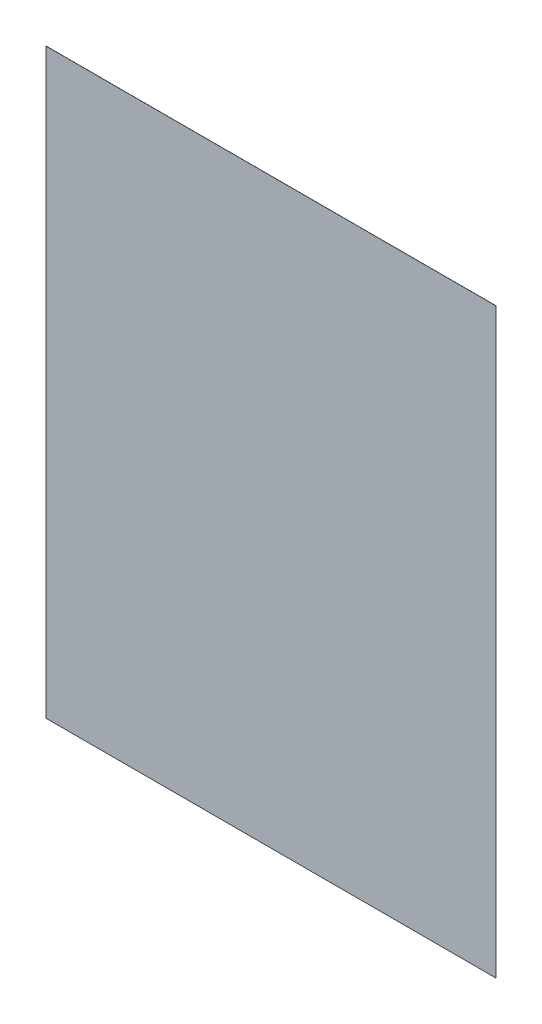
from build123d import *

# Parameters (mm, degrees)
SKETCH1_W           = 215.9
SKETCH1_H           = 279.4
BOSS_EXTRUDE1_DEPTH = 0.05


with BuildPart() as part:
    # Sketch1 → Boss-Extrude1 (new body)
    with BuildSketch(Plane.XY):
        Rectangle(SKETCH1_W, SKETCH1_H)
    extrude(amount=BOSS_EXTRUDE1_DEPTH)


solid = part.part
